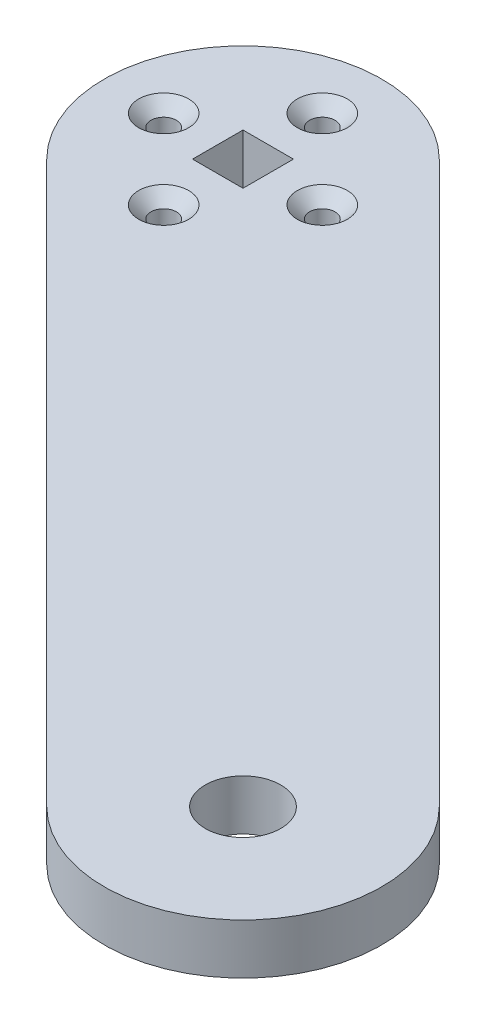
from build123d import *

# Parameters (mm, degrees)
SKETCH2_R                                       = 4.7625
SKETCH2_W                                       = 6.36
SKETCH2_H                                       = 6.36
BOSS_EXTRUDE1_DEPTH                             = 6.35
CSK_FOR_M3_FLAT_HEAD_MACHINE_SCREW1_D           = 3.2
CSK_FOR_M3_FLAT_HEAD_MACHINE_SCREW1_CSINK_D     = 6.3
CSK_FOR_M3_FLAT_HEAD_MACHINE_SCREW1_CSINK_ANGLE = 90


with BuildPart() as part:
    # Sketch2 → Boss-Extrude1 (new body)
    with BuildSketch(Plane(origin=(0, 0, 0), x_dir=(1, 0, 0), z_dir=(0, 1, 0))):
        with BuildLine():
            Line((12.374368671, 12.374368671), (83.085046789, -58.336309448))
            ThreePointArc((83.085046789, -58.336309448), (83.085046789, -83.085046789), (58.336309448, -83.085046789))
            Line((58.336309448, -83.085046789), (-12.374368671, -12.374368671))
            ThreePointArc((-12.374368671, -12.374368671), (-12.374368671, 12.374368671), (12.374368671, 12.374368671))
        make_face()
        with Locations(Location((70.710678119, -70.710678119, 0), (0, 0, 270))):
            Circle(SKETCH2_R, mode=Mode.SUBTRACT)
        Rectangle(SKETCH2_W, SKETCH2_H, mode=Mode.SUBTRACT)
    extrude(amount=-BOSS_EXTRUDE1_DEPTH)

    # CSK for M3 Flat Head Machine Screw1 (through all)
    with Locations(Plane(origin=(0, 0, -10), x_dir=(0, 0, 1), z_dir=(0, 1, 0))):
        with Locations((0, 0), (10, -10), (10, 10), (20, 0)):
            CounterSinkHole(CSK_FOR_M3_FLAT_HEAD_MACHINE_SCREW1_D / 2, CSK_FOR_M3_FLAT_HEAD_MACHINE_SCREW1_CSINK_D / 2, counter_sink_angle=CSK_FOR_M3_FLAT_HEAD_MACHINE_SCREW1_CSINK_ANGLE)


solid = part.part
